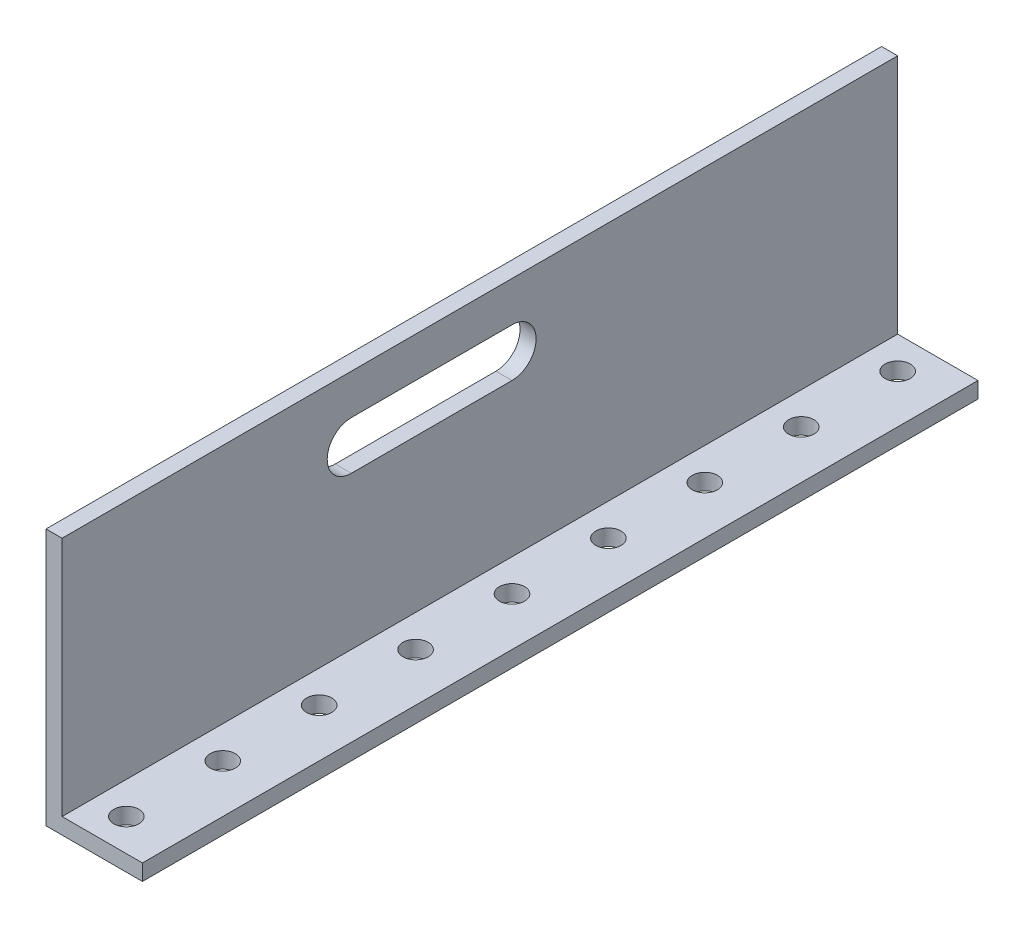
from build123d import *

# Parameters (mm, degrees)
SKETCH1_W           = 3.175
SKETCH1_H           = 47.625
SKETCH1_H_2         = 3.175
SKETCH1_W_2         = 15.875
BOSS_EXTRUDE1_DEPTH = 165.1
SKETCH2_R           = 2.4892
CUT_EXTRUDE1_DEPTH  = 165.1
SKETCH3_R           = 4.7625
CUT_EXTRUDE2_DEPTH  = 184.15


with BuildPart() as part:
    # Sketch1 → Boss-Extrude1 (new body)
    with BuildSketch(Plane.XY):
        with Locations((1.5875, 26.9875)):
            Rectangle(SKETCH1_W, SKETCH1_H)
        with Locations((1.5875, 1.5875)):
            Rectangle(SKETCH1_W, SKETCH1_H_2)
        with Locations((11.1125, 1.5875)):
            Rectangle(SKETCH1_W_2, SKETCH1_H_2)
    extrude(amount=BOSS_EXTRUDE1_DEPTH)

    # Sketch2 → Cut-Extrude1 (cut)
    with BuildSketch(Plane(origin=(0, 3.175, 0), x_dir=(1, 0, 0), z_dir=(0, 1, 0))):
        with Locations(Location((9.525, -6.35, 0), (0, 0, 270))):
            Circle(SKETCH2_R)
        with Locations(Location((9.525, -25.4, 0), (0, 0, 270))):
            Circle(SKETCH2_R)
        with Locations(Location((9.525, -44.45, 0), (0, 0, 270))):
            Circle(SKETCH2_R)
        with Locations(Location((9.525, -63.5, 0), (0, 0, 270))):
            Circle(SKETCH2_R)
        with Locations(Location((9.525, -82.55, 0), (0, 0, 270))):
            Circle(SKETCH2_R)
        with Locations(Location((9.525, -101.6, 0), (0, 0, 270))):
            Circle(SKETCH2_R)
        with Locations(Location((9.525, -120.65, 0), (0, 0, 270))):
            Circle(SKETCH2_R)
        with Locations(Location((9.525, -139.7, 0), (0, 0, 270))):
            Circle(SKETCH2_R)
        with Locations(Location((9.525, -158.75, 0), (0, 0, 270))):
            Circle(SKETCH2_R)
    extrude(amount=-CUT_EXTRUDE1_DEPTH, mode=Mode.SUBTRACT)

    # Sketch3 → Cut-Extrude2 (cut)
    with BuildSketch(Plane.ZY):
        with BuildLine():
            Line((107.95, 42.8625), (76.2, 42.8625))
            ThreePointArc((76.2, 42.8625), (79.567596045, 41.467596045), (80.9625, 38.1))
            ThreePointArc((80.9625, 38.1), (79.567596045, 34.732403955), (76.2, 33.3375))
            Line((76.2, 33.3375), (107.95, 33.3375))
            ThreePointArc((107.95, 33.3375), (103.1875, 38.1), (107.95, 42.8625))
        make_face()
        with Locations((76.2, 38.1)):
            Circle(SKETCH3_R)
        with Locations((107.95, 38.1)):
            Circle(SKETCH3_R)
    extrude(amount=-CUT_EXTRUDE2_DEPTH, mode=Mode.SUBTRACT)


solid = part.part
